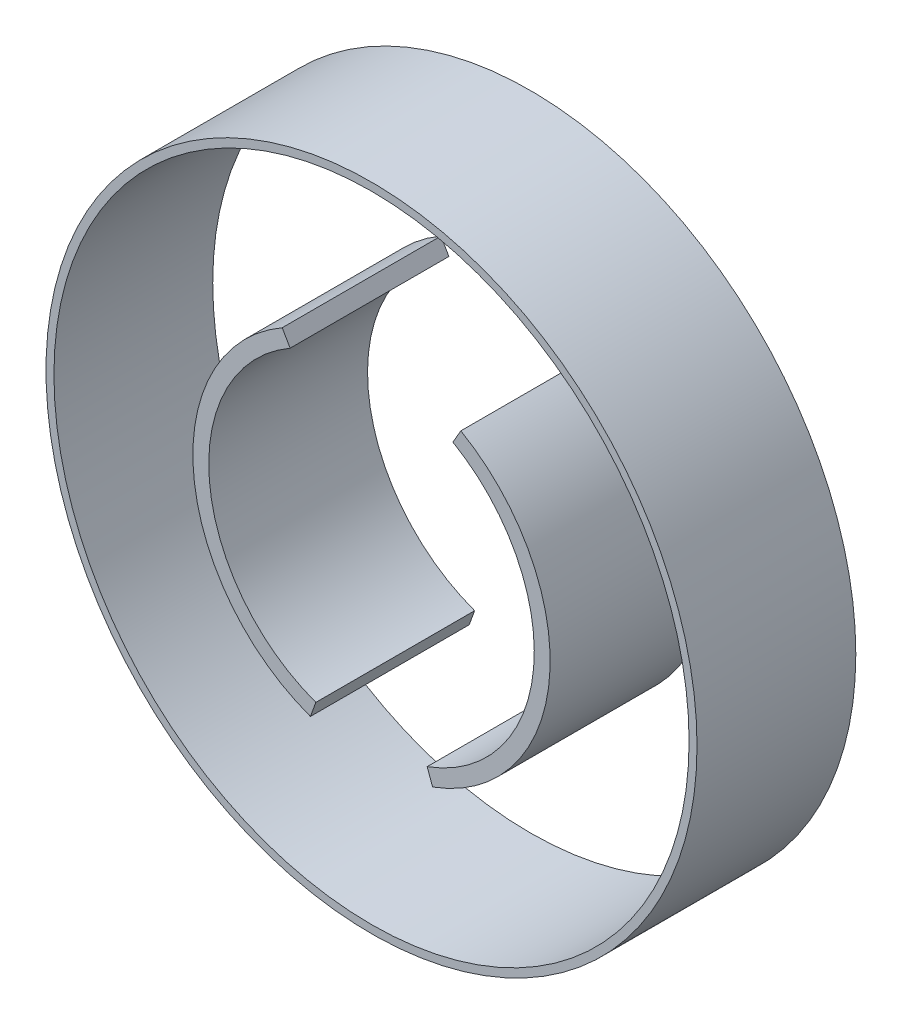
from build123d import *

# Parameters (mm, degrees)
SKETCH_1_R        = 4100
SKETCH_1_R_2      = 4000
EXTRUDE_1_DEPTH   = 2000
EXTRUDE_2_DEPTH   = 2000
EXTRUDE_2_2_DEPTH = 2000


with BuildPart() as part:
    # 草图1 → 凸台-拉伸1 (new body)
    with BuildSketch(Plane.XY):
        Circle(SKETCH_1_R)
        Circle(SKETCH_1_R_2, mode=Mode.SUBTRACT)
    extrude(amount=EXTRUDE_1_DEPTH)


with BuildPart() as body_2:
    # 草图2 → 凸台-拉伸2 (new body)
    with BuildSketch(Plane.XY):
        with BuildLine():
            Line((-769.545322483, -2114.308396768), (-701.141293818, -1926.369872611))
            ThreePointArc((-701.141293818, -1926.369872611), (-2042.199131088, -178.669272633), (-1025, 1775.352077758))
            Line((-1025, 1775.352077758), (-1125, 1948.557158515))
            ThreePointArc((-1125, 1948.557158515), (-2241.438070706, -196.100421182), (-769.545322483, -2114.308396768))
        make_face()
    extrude(amount=EXTRUDE_2_DEPTH)


with BuildPart() as body_3:
    # 草图2 → Extrude 2 2 (new body)
    with BuildSketch(Plane.XY):
        with BuildLine():
            Line((769.545322483, -2114.308396768), (701.141293818, -1926.369872611))
            ThreePointArc((701.141293818, -1926.369872611), (2042.199131088, -178.669272633), (1025, 1775.352077758))
            Line((1025, 1775.352077758), (1125, 1948.557158515))
            ThreePointArc((1125, 1948.557158515), (2241.438070706, -196.100421182), (769.545322483, -2114.308396768))
        make_face()
    extrude(amount=EXTRUDE_2_2_DEPTH)


solid = Compound([part.part, body_2.part, body_3.part])
